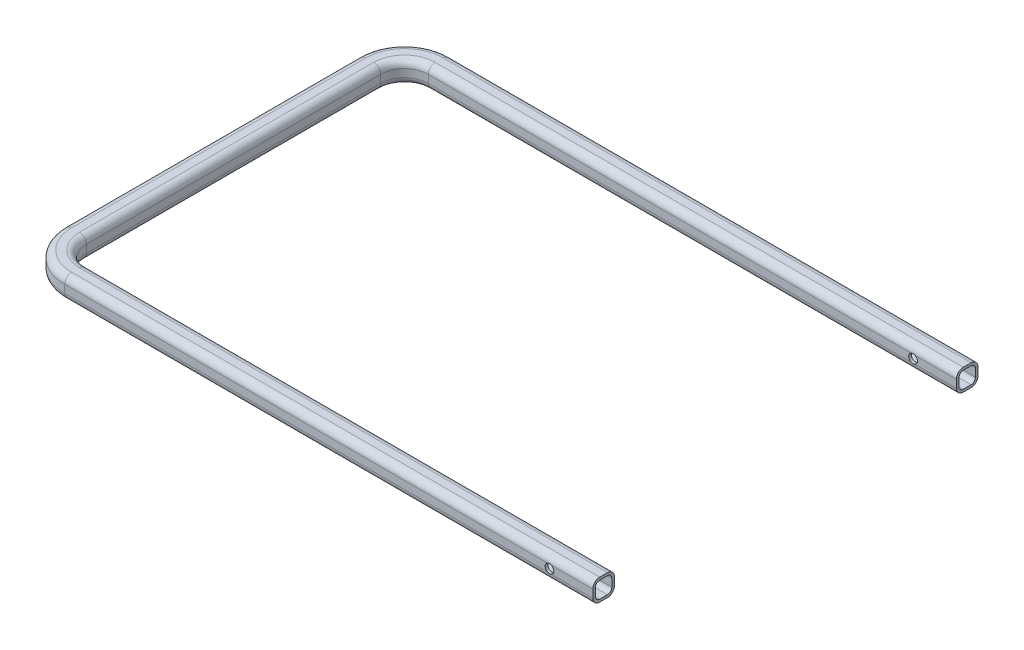
from build123d import *

# Parameters (mm, degrees)
CUT_EXTRUDE1_DEPTH      = 792.276658459
CUT_EXTRUDE1_DEPTH_BACK = 792.276658459
SKETCH3_R               = 5


with BuildPart() as part:
    # Sweep-Thin1: sweep along a path in Sketch1
    with BuildLine(Plane(origin=(0, 0, 0), x_dir=(1, 0, 0), z_dir=(0, 1, 0))) as sweep_thin1_path:
        Line((0, 0), (-610, 0))
        ThreePointArc((-610, 0), (-638.284271247, 11.715728753), (-650, 40))
        Line((-650, 40), (-650, 380))
        ThreePointArc((-650, 380), (-638.284271247, 408.284271247), (-610, 420))
        Line((-610, 420), (0, 420))
    # Sketch2 → Sweep-Thin1 (sweep)
    with BuildSketch(Plane(origin=(0, 0, 0), x_dir=(0, 0, -1), z_dir=(1, 0, 0))):
        with BuildLine():
            Line((4.5, 12.5), (-4.5, 12.5))
            ThreePointArc((-4.5, 12.5), (-10.156854249, 10.156854249), (-12.5, 4.5))
            Line((-12.5, 4.5), (-12.5, -4.5))
            ThreePointArc((-12.5, -4.5), (-10.156854249, -10.156854249), (-4.5, -12.5))
            Line((-4.5, -12.5), (4.5, -12.5))
            ThreePointArc((4.5, -12.5), (10.156854249, -10.156854249), (12.5, -4.5))
            Line((12.5, -4.5), (12.5, 4.5))
            ThreePointArc((12.5, 4.5), (10.156854249, 10.156854249), (4.5, 12.5))
        make_face()
        with BuildLine():
            Line((4.5, 9.5), (-4.5, 9.5))
            ThreePointArc((-4.5, 9.5), (-8.035533906, 8.035533906), (-9.5, 4.5))
            Line((-9.5, 4.5), (-9.5, -4.5))
            ThreePointArc((-9.5, -4.5), (-8.035533906, -8.035533906), (-4.5, -9.5))
            Line((-4.5, -9.5), (4.5, -9.5))
            ThreePointArc((4.5, -9.5), (8.035533906, -8.035533906), (9.5, -4.5))
            Line((9.5, -4.5), (9.5, 4.5))
            ThreePointArc((9.5, 4.5), (8.035533906, 8.035533906), (4.5, 9.5))
        make_face(mode=Mode.SUBTRACT)
    sweep(path=sweep_thin1_path.line)

    # Sketch3 → Cut-Extrude1 (cut, two sides: drawn at the far end of the back side and taken through both)
    with BuildSketch(Plane.XY.offset(-CUT_EXTRUDE1_DEPTH_BACK)):
        with Locations(Location((-50, 0, 0), (0, 0, 64.158067237))):
            Circle(SKETCH3_R)
    extrude(amount=CUT_EXTRUDE1_DEPTH + CUT_EXTRUDE1_DEPTH_BACK, mode=Mode.SUBTRACT)


solid = part.part
